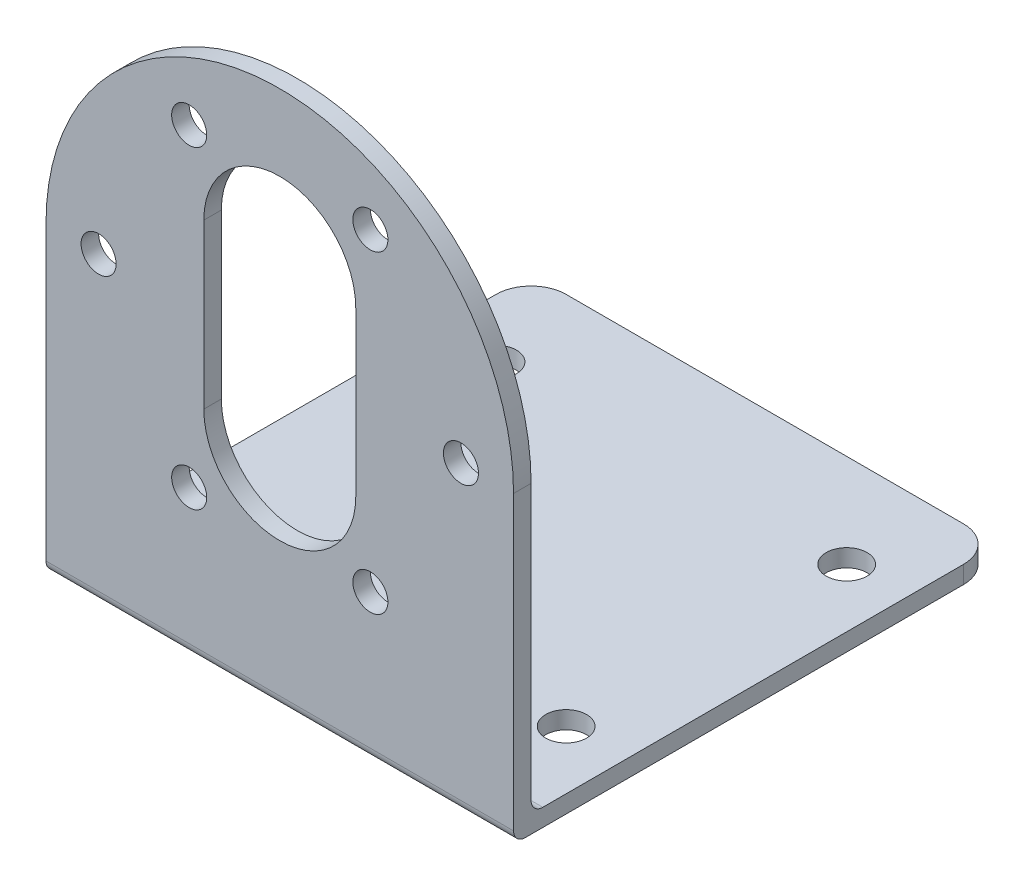
from build123d import *

# Parameters (mm, degrees)
SKETCH_1_R          = 1.5
EXTRUDE_1_DEPTH     = 1.5
SKETCH_2_W          = 40
SKETCH_2_H          = 1.5
EXTRUDE_2_DEPTH     = 40
SKETCH_3_R          = 1.75
CUT_EXTRUDE_1_DEPTH = 40
FILLET_1_R          = 3
FILLET_2_R          = 1


with BuildPart() as part:
    # 草图1 → 凸台-拉伸1 (new body)
    with BuildSketch(Plane.XY):
        with BuildLine():
            Line((-20, 0), (-20, -26))
            Line((-20, -26), (20, -26))
            Line((20, -26), (20, 0))
            ThreePointArc((20, 0), (0, 20), (-20, 0))
        make_face()
        with Locations((-7.75, 13.423393759)):
            Circle(SKETCH_1_R, mode=Mode.SUBTRACT)
        with Locations((7.75, 13.423393759)):
            Circle(SKETCH_1_R, mode=Mode.SUBTRACT)
        with Locations((15.5, 0)):
            Circle(SKETCH_1_R, mode=Mode.SUBTRACT)
        with Locations((7.75, -13.423393759)):
            Circle(SKETCH_1_R, mode=Mode.SUBTRACT)
        with Locations((-7.75, -13.423393759)):
            Circle(SKETCH_1_R, mode=Mode.SUBTRACT)
        with Locations((-15.5, 0)):
            Circle(SKETCH_1_R, mode=Mode.SUBTRACT)
        with BuildLine():
            Line((-6.5, 7), (-6.5, -7))
            ThreePointArc((-6.5, -7), (0, -13.5), (6.5, -7))
            Line((6.5, -7), (6.5, 7))
            ThreePointArc((6.5, 7), (0, 13.5), (-6.5, 7))
        make_face(mode=Mode.SUBTRACT)
    extrude(amount=EXTRUDE_1_DEPTH)

    # 草图2 → 凸台-拉伸2 (add)
    with BuildSketch(Plane(origin=(0, 0, 0), x_dir=(-1, 0, 0), z_dir=(0, 0, -1))):
        with Locations((0, -25.25)):
            Rectangle(SKETCH_2_W, SKETCH_2_H)
    extrude(amount=EXTRUDE_2_DEPTH)

    # 草图3 → 切除-拉伸1 (cut)
    with BuildSketch(Plane(origin=(0, -24.5, 0), x_dir=(1, 0, 0), z_dir=(0, 1, 0))):
        with Locations(Location((-15, 32, 0), (0, 0, 270))):
            Circle(SKETCH_3_R)
        with Locations(Location((-15, 8, 0), (0, 0, 270))):
            Circle(SKETCH_3_R)
        with Locations(Location((15, 8, 0), (0, 0, 270))):
            Circle(SKETCH_3_R)
        with Locations(Location((15, 32, 0), (0, 0, 270))):
            Circle(SKETCH_3_R)
    extrude(amount=-CUT_EXTRUDE_1_DEPTH, mode=Mode.SUBTRACT)

    # 圆角1
    fillet_1_edges = [part.edges().sort_by_distance(p)[0] for p in [
        (20, -25.25, -40),
        (-20, -25.25, -40),
    ]]
    fillet(fillet_1_edges, radius=FILLET_1_R)

    # 圆角2
    fillet_2_edges = [part.edges().sort_by_distance(p)[0] for p in [
        (0, -24.5, 0),
        (0, -26, 1.5),
    ]]
    fillet(fillet_2_edges, radius=FILLET_2_R)


solid = part.part
